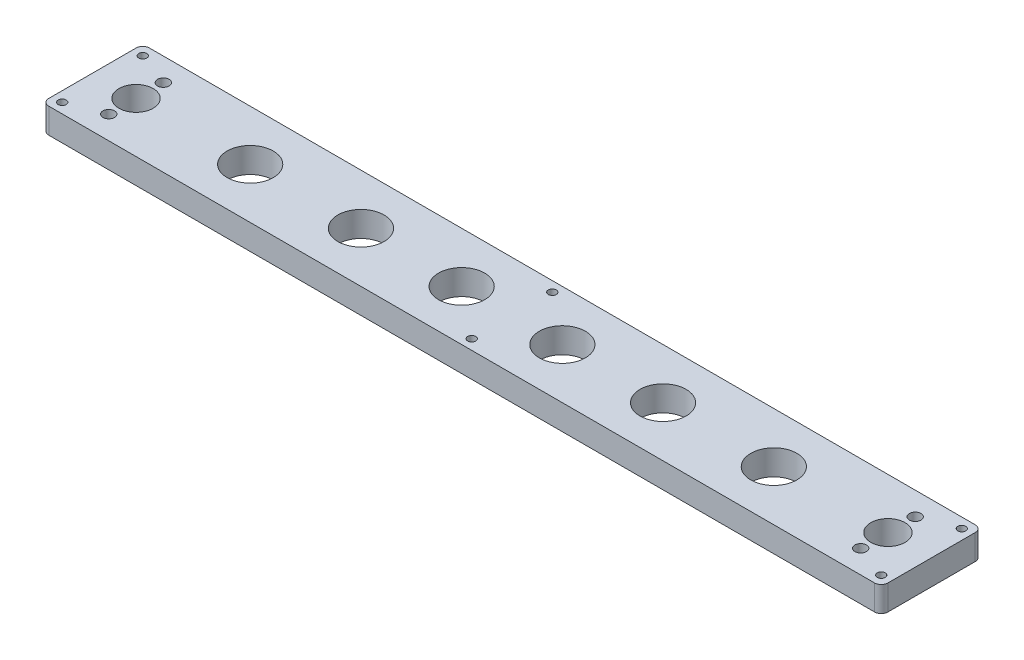
from build123d import *

# Parameters (mm, degrees)
SKETCH1_W           = 317.5
SKETCH1_H           = 38.1
BOSS_EXTRUDE1_DEPTH = 4.7625
SKETCH2_R           = 4.4196
SKETCH2_R_2         = 6.477
SKETCH2_R_3         = 2.19075
CUT_EXTRUDE1_DEPTH  = 161.172377846
SKETCH3_R           = 1.5113
CUT_EXTRUDE2_DEPTH  = 161.172377846
FILLET1_R           = 2.54
SKETCH4_R           = 8.73125
CUT_EXTRUDE3_DEPTH  = 161.172377846


with BuildPart() as part:
    # Sketch1 → Boss-Extrude1 (new, symmetric)
    with BuildSketch(Plane(origin=(0, 0, 0), x_dir=(1, 0, 0), z_dir=(0, 1, 0))):
        Rectangle(SKETCH1_W, SKETCH1_H)
    extrude(amount=BOSS_EXTRUDE1_DEPTH, both=True)

    # Sketch2 → Cut-Extrude1 (cut, through all)
    with BuildSketch(Plane(origin=(0, 4.7625, 0), x_dir=(1, 0, 0), z_dir=(0, 1, 0))):
        with Locations(Location((-99.06, 0, 0), (0, 0, 270))):
            Circle(SKETCH2_R)
        with Locations(Location((-57.15, 0, 0), (0, 0, 270))):
            Circle(SKETCH2_R)
        with Locations(Location((-19.05, 0, 0), (0, 0, 270))):
            Circle(SKETCH2_R)
        with Locations(Location((19.05, 0, 0), (0, 0, 270))):
            Circle(SKETCH2_R)
        with Locations(Location((57.15, 0, 0), (0, 0, 270))):
            Circle(SKETCH2_R)
        with Locations(Location((-142.24, 0, 0), (0, 0, 270))):
            Circle(SKETCH2_R_2)
        with Locations(Location((-142.24, -10.31875, 0), (0, 0, 270))):
            Circle(SKETCH2_R_3)
        with Locations(Location((-142.24, 10.31875, 0), (0, 0, 270))):
            Circle(SKETCH2_R_3)
        with Locations(Location((142.24, 0, 0), (0, 0, 270))):
            Circle(SKETCH2_R_2)
        with Locations(Location((142.24, -10.31875, 0), (0, 0, 270))):
            Circle(SKETCH2_R_3)
        with Locations(Location((142.24, 10.31875, 0), (0, 0, 270))):
            Circle(SKETCH2_R_3)
        with Locations(Location((99.06, 0, 0), (0, 0, 270))):
            Circle(SKETCH2_R)
    extrude(amount=-CUT_EXTRUDE1_DEPTH, mode=Mode.SUBTRACT)

    # Sketch3 → Cut-Extrude2 (cut, through all)
    with BuildSketch(Plane(origin=(0, 4.7625, 0), x_dir=(1, 0, 0), z_dir=(0, 1, 0))):
        with Locations(Location((-154.94, 15.24, 0), (0, 0, 270))):
            Circle(SKETCH3_R)
        with Locations(Location((-154.94, -15.24, 0), (0, 0, 270))):
            Circle(SKETCH3_R)
        with Locations(Location((154.94, -15.24, 0), (0, 0, 270))):
            Circle(SKETCH3_R)
        with Locations(Location((154.94, 15.24, 0), (0, 0, 270))):
            Circle(SKETCH3_R)
        with Locations(Location((0, 15.24, 0), (0, 0, 270))):
            Circle(SKETCH3_R)
        with Locations(Location((0, -15.24, 0), (0, 0, 270))):
            Circle(SKETCH3_R)
    extrude(amount=-CUT_EXTRUDE2_DEPTH, mode=Mode.SUBTRACT)

    # Fillet1
    fillet1_edges = [part.edges().sort_by_distance(p)[0] for p in [
        (158.75, 0, 19.05),
        (-158.75, 0, 19.05),
        (-158.75, 0, -19.05),
        (158.75, 0, -19.05),
    ]]
    fillet(fillet1_edges, radius=FILLET1_R)

    # Sketch4 → Cut-Extrude3 (cut, through all)
    with BuildSketch(Plane(origin=(0, 4.7625, 0), x_dir=(1, 0, 0), z_dir=(0, 1, 0))):
        with Locations(Location((99.06, 0, 0), (0, 0, 270))):
            Circle(SKETCH4_R)
        with Locations(Location((-99.06, 0, 0), (0, 0, 270))):
            Circle(SKETCH4_R)
        with Locations(Location((-57.15, 0, 0), (0, 0, 270))):
            Circle(SKETCH4_R)
        with Locations(Location((-19.05, 0, 0), (0, 0, 270))):
            Circle(SKETCH4_R)
        with Locations(Location((19.05, 0, 0), (0, 0, 270))):
            Circle(SKETCH4_R)
        with Locations(Location((57.15, 0, 0), (0, 0, 270))):
            Circle(SKETCH4_R)
    extrude(amount=-CUT_EXTRUDE3_DEPTH, mode=Mode.SUBTRACT)


solid = part.part
